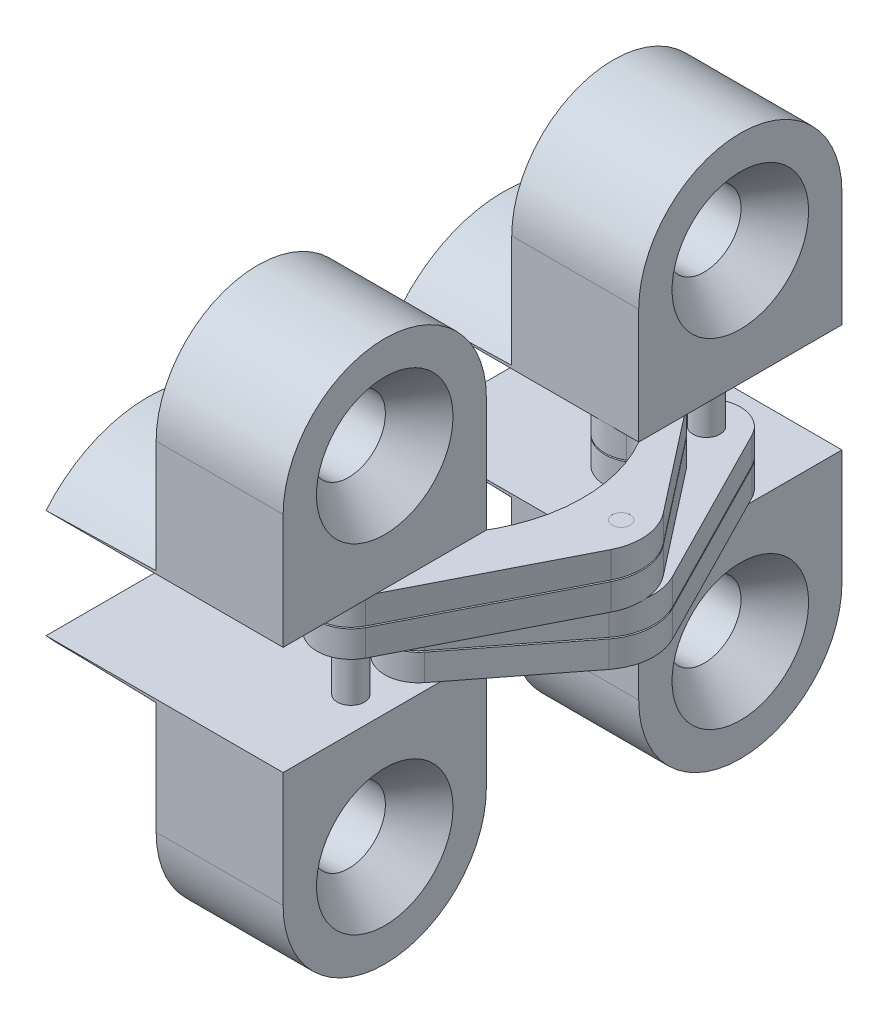
from build123d import *

# Parameters (mm, degrees)
EXTRUDE1_DEPTH                                = 11.1125
EXTRUDE1_2_DEPTH                              = 11.1125
SKETCH16_W                                    = 26.19375
SKETCH16_H                                    = 5.08
CUT_EXTRUDE1_DEPTH                            = 22.361315292
SKETCH34_R                                    = 0.635
SKETCH34_R_2                                  = 0.423333333
EXTRUDE18_DEPTH                               = 2.54
SKETCH35_R                                    = 0.635
SKETCH35_R_2                                  = 0.423333333
EXTRUDE19_DEPTH                               = 2.54
FILLET7_R                                     = 2.54
FILLET8_R                                     = 2.54
SKETCH13_R                                    = 0.635
EXTRUDE11_DEPTH                               = 5.08
EXTRUDE11_2_DEPTH                             = 5.08
EXTRUDE11_3_DEPTH                             = 5.08
EXTRUDE11_4_DEPTH                             = 5.08
CUT_EXTRUDE3_DEPTH                            = 22.361315292
CUT_EXTRUDE3_DEPTH_BACK                       = 22.361315292
SKETCH38_W                                    = 26.19375
SKETCH38_H                                    = 0.0635
CSK_FOR_5_FLAT_HEAD_MACHINE_SCREW1_AT_2_COUNT = 2
CSK_FOR_5_FLAT_HEAD_MACHINE_SCREW1_AT_2_PITCH = 16.66875
CSK_FOR_5_FLAT_HEAD_MACHINE_SCREW1_AT_3_COUNT = 2
CSK_FOR_5_FLAT_HEAD_MACHINE_SCREW1_AT_3_PITCH = 15.875
CSK_FOR_5_FLAT_HEAD_MACHINE_SCREW1_AT_4_COUNT = 2
CSK_FOR_5_FLAT_HEAD_MACHINE_SCREW1_AT_4_PITCH = 23.01875
SKETCH33_R                                    = 0.423333333
EXTRUDE17_DEPTH                               = 5.08
SKETCH32_OUTSIDE_W                            = 36.272
SKETCH32_OUTSIDE_H                            = 35.478
CUT_EXTRUDE2_DEPTH                            = 5.159375
CUT_EXTRUDE2_DRAFT                            = -1


with BuildPart() as part:
    # Sketch1 → Extrude1 (new body)
    with BuildSketch(Plane(origin=(0, 0, 0), x_dir=(0, 0, -1), z_dir=(1, 0, 0))):
        with BuildLine():
            Line((-13.096875, 7.9375), (-13.096875, -7.9375))
            ThreePointArc((-13.096875, -7.9375), (-8.334375, -12.7), (-3.571875, -7.9375))
            Line((-3.571875, -7.9375), (-3.571875, 7.9375))
            ThreePointArc((-3.571875, 7.9375), (-8.334375, 12.7), (-13.096875, 7.9375))
        make_face()
    extrude(amount=-EXTRUDE1_DEPTH)


with BuildPart() as body_2:
    # Sketch1 → Extrude1 2 (new body)
    with BuildSketch(Plane(origin=(0, 0, 0), x_dir=(0, 0, -1), z_dir=(1, 0, 0))):
        with BuildLine():
            Line((3.571875, 7.9375), (3.571875, -7.9375))
            ThreePointArc((3.571875, -7.9375), (8.334375, -12.7), (13.096875, -7.9375))
            Line((13.096875, -7.9375), (13.096875, 7.9375))
            ThreePointArc((13.096875, 7.9375), (8.334375, 12.7), (3.571875, 7.9375))
        make_face()
    extrude(amount=-EXTRUDE1_2_DEPTH)


with BuildPart() as cut_extrude1_tool:
    # Sketch16 → Cut-Extrude1 (new, through all)
    with BuildSketch(Plane(origin=(0, 0, 0), x_dir=(0, 0, -1), z_dir=(1, 0, 0))):
        Rectangle(SKETCH16_W, SKETCH16_H)
    extrude(amount=-CUT_EXTRUDE1_DEPTH)


with BuildPart() as part_1:
    add(part.part)

    # Cut-Extrude1: cut by cut_extrude1_tool
    add(cut_extrude1_tool.part, mode=Mode.SUBTRACT)


with BuildPart() as body_2_1:
    add(body_2.part)

    # Cut-Extrude1: cut by cut_extrude1_tool
    add(cut_extrude1_tool.part, mode=Mode.SUBTRACT)


with BuildPart() as cut_extrude1_piece_1:
    # of the separate pieces the step leaves, piece 1, a body of its own (cut_extrude1_pieces)
    add(part_1.part.solids().sort_by_distance((0, 7.9375, 3.571875))[0])

    # Sketch30 → CSK for #5 Flat Head Machine Screw1 (revolve, cut)
    with BuildSketch(Plane(origin=(0, 7.9375, 8.334375), x_dir=(0, 0, -1), z_dir=(0, 1, 0))):
        Polygon((0, 0), (0, 11.1125), (1.7272, 11.1125), (1.7272, 1.694722738), (3.2004, 0), align=None)
    csk_for_5_flat_head_machine_screw1 = revolve(axis=Axis((6.35, 7.9375, 8.334375), (-1, 0, 0)), mode=Mode.SUBTRACT)


with BuildPart() as cut_extrude1_piece_2:
    # of the separate pieces the step leaves, piece 2, a body of its own (cut_extrude1_pieces)
    add(part_1.part.solids().sort_by_distance((0, -7.9375, 3.571875))[0])

    # CSK for #5 Flat Head Machine Screw1 at 3: CSK for #5 Flat Head Machine Screw1 ×2
    with Locations(*[(0, -i * CSK_FOR_5_FLAT_HEAD_MACHINE_SCREW1_AT_3_PITCH, 0) for i in range(1, CSK_FOR_5_FLAT_HEAD_MACHINE_SCREW1_AT_3_COUNT)]):
        add(csk_for_5_flat_head_machine_screw1, mode=Mode.SUBTRACT)


with BuildPart() as cut_extrude1_piece_1_of_body_2:
    # of the separate pieces the step leaves, piece 1, a body of its own (cut_extrude1_pieces_of_body_2)
    add(body_2_1.part.solids().sort_by_distance((0, 7.9375, -13.096875))[0])

    # CSK for #5 Flat Head Machine Screw1 at 2: CSK for #5 Flat Head Machine Screw1 ×2
    with Locations(*[(0, 0, -i * CSK_FOR_5_FLAT_HEAD_MACHINE_SCREW1_AT_2_PITCH) for i in range(1, CSK_FOR_5_FLAT_HEAD_MACHINE_SCREW1_AT_2_COUNT)]):
        add(csk_for_5_flat_head_machine_screw1, mode=Mode.SUBTRACT)


with BuildPart() as cut_extrude1_piece_2_of_body_2:
    # of the separate pieces the step leaves, piece 2, a body of its own (cut_extrude1_pieces_of_body_2)
    add(body_2_1.part.solids().sort_by_distance((0, -7.9375, -13.096875))[0])

    # CSK for #5 Flat Head Machine Screw1 at 4: CSK for #5 Flat Head Machine Screw1 ×2
    with Locations(*[Vector(0, -0.689655172413793, -0.7241379310344829) * (i * CSK_FOR_5_FLAT_HEAD_MACHINE_SCREW1_AT_4_PITCH) for i in range(1, CSK_FOR_5_FLAT_HEAD_MACHINE_SCREW1_AT_4_COUNT)]):
        add(csk_for_5_flat_head_machine_screw1, mode=Mode.SUBTRACT)


with BuildPart() as body_5:
    # Sketch34 → Extrude18 (new body)
    with BuildSketch(Plane.XZ.offset(-2.54)):
        with BuildLine():
            Line((-0.173294523, 9.055609441), (4.445, 0))
            Line((4.445, 0), (-0.335245678, -6.135087746))
            ThreePointArc((-0.335245678, -6.135087746), (-3.145633171, -5.463311295), (-0.79375, -3.784559671))
            ThreePointArc((-0.79375, -3.784559671), (-0.352826562, -3.842608343), (0, -3.571875))
            ThreePointArc((0, -3.571875), (0.941237875, 0.475508106), (-0.529274955, 4.362001481))
            Line((-0.529274955, 4.362001481), (-2.844698672, 7.365041337))
            ThreePointArc((-2.844698672, 7.365041337), (-2.436421617, 9.675825088), (-0.173294523, 9.055609441))
        make_face()
        with Locations(Location((-1.5875, 8.334375, 0), (0, 0, 270))):
            Circle(SKETCH34_R, mode=Mode.SUBTRACT)
        with Locations(Location((-1.5875, -5.159375, 0), (0, 0, 270))):
            Circle(SKETCH34_R, mode=Mode.SUBTRACT)
        with Locations(Location((2.751666667, 0, 0), (0, 0, 270))):
            Circle(SKETCH34_R_2, mode=Mode.SUBTRACT)
    extrude(amount=EXTRUDE18_DEPTH)

    # Fillet7
    fillet7_edges = [body_5.edges().sort_by_distance(p)[0] for p in [
        (4.445, 1.27, 0),
    ]]
    fillet(fillet7_edges, radius=FILLET7_R)


with BuildPart() as body_6:
    # Sketch35 → Extrude19 (new body)
    with BuildSketch(Plane.XZ):
        with BuildLine():
            Line((-2.844698672, -7.365041337), (-0.529274955, -4.362001481))
            ThreePointArc((-0.529274955, -4.362001481), (0.941237875, -0.475508106), (0, 3.571875))
            ThreePointArc((0, 3.571875), (-0.352826562, 3.842608343), (-0.79375, 3.784559671))
            ThreePointArc((-0.79375, 3.784559671), (-3.145633171, 5.463311295), (-0.335245678, 6.135087746))
            Line((-0.335245678, 6.135087746), (4.445, 0))
            Line((4.445, 0), (-0.173294523, -9.055609441))
            ThreePointArc((-0.173294523, -9.055609441), (-2.436421617, -9.675825088), (-2.844698672, -7.365041337))
        make_face()
        with Locations(Location((-1.5875, -8.334375, 0), (0, 0, 270))):
            Circle(SKETCH35_R, mode=Mode.SUBTRACT)
        with Locations(Location((-1.5875, 5.159375, 0), (0, 0, 270))):
            Circle(SKETCH35_R, mode=Mode.SUBTRACT)
        with Locations(Location((2.751666667, 0, 0), (0, 0, 270))):
            Circle(SKETCH35_R_2, mode=Mode.SUBTRACT)
    extrude(amount=EXTRUDE19_DEPTH)

    # Fillet8
    fillet8_edges = [body_6.edges().sort_by_distance(p)[0] for p in [
        (4.445, -1.27, 0),
    ]]
    fillet(fillet8_edges, radius=FILLET8_R)


with BuildPart() as body_7:
    # Sketch13 → Extrude11 (new body)
    with BuildSketch(Plane(origin=(0, -2.54, 0), x_dir=(-1, 0, 0), z_dir=(0, 1, 0))):
        with Locations(Location((1.5875, 8.334375, 0), (0, 0, 90))):
            Circle(SKETCH13_R)
    extrude(amount=EXTRUDE11_DEPTH)


with BuildPart() as body_8:
    # Sketch13 → Extrude11 2 (new body)
    with BuildSketch(Plane(origin=(0, -2.54, 0), x_dir=(-1, 0, 0), z_dir=(0, 1, 0))):
        with Locations(Location((1.5875, 5.159375, 0), (0, 0, 90))):
            Circle(SKETCH13_R)
    extrude(amount=EXTRUDE11_2_DEPTH)


with BuildPart() as body_9:
    # Sketch13 → Extrude11 3 (new body)
    with BuildSketch(Plane(origin=(0, -2.54, 0), x_dir=(-1, 0, 0), z_dir=(0, 1, 0))):
        with Locations(Location((1.5875, -8.334375, 0), (0, 0, 90))):
            Circle(SKETCH13_R)
    extrude(amount=EXTRUDE11_3_DEPTH)


with BuildPart() as body_10:
    # Sketch13 → Extrude11 4 (new body)
    with BuildSketch(Plane(origin=(0, -2.54, 0), x_dir=(-1, 0, 0), z_dir=(0, 1, 0))):
        with Locations(Location((1.5875, -5.159375, 0), (0, 0, 90))):
            Circle(SKETCH13_R)
    extrude(amount=EXTRUDE11_4_DEPTH)


with BuildPart() as cut_extrude3_tool:
    # Sketch38 → Cut-Extrude3 (new, two sides: drawn at the far end of the back side and taken through both)
    with BuildSketch(Plane(origin=(0, 0, 0), x_dir=(0, 0, -1), z_dir=(1, 0, 0)).offset(-CUT_EXTRUDE3_DEPTH_BACK)):
        with Locations((0, 1.27)):
            Rectangle(SKETCH38_W, SKETCH38_H)
        with Locations((0, -1.27)):
            Rectangle(SKETCH38_W, SKETCH38_H)
    extrude(amount=CUT_EXTRUDE3_DEPTH + CUT_EXTRUDE3_DEPTH_BACK)


with BuildPart() as body_5_1:
    add(body_5.part)

    # Cut-Extrude3: cut by cut_extrude3_tool
    add(cut_extrude3_tool.part, mode=Mode.SUBTRACT)


with BuildPart() as body_6_1:
    add(body_6.part)

    # Cut-Extrude3: cut by cut_extrude3_tool
    add(cut_extrude3_tool.part, mode=Mode.SUBTRACT)


with BuildPart() as cut_extrude3_piece_1:
    # of the separate pieces the step leaves, piece 1, a body of its own (cut_extrude3_pieces)
    add(body_5_1.part.solids().sort_by_distance((3.710604976, 2.54, 1.440010913))[0])


with BuildPart() as cut_extrude3_piece_2:
    # of the separate pieces the step leaves, piece 2, a body of its own (cut_extrude3_pieces)
    add(body_5_1.part.solids().sort_by_distance((3.710604976, 1.23825, 1.440010913))[0])


with BuildPart() as cut_extrude3_piece_1_of_body_6:
    # of the separate pieces the step leaves, piece 1, a body of its own (cut_extrude3_pieces_of_body_6)
    add(body_6_1.part.solids().sort_by_distance((3.451483128, 0, 1.275104586))[0])


with BuildPart() as cut_extrude3_piece_2_of_body_6:
    # of the separate pieces the step leaves, piece 2, a body of its own (cut_extrude3_pieces_of_body_6)
    add(body_6_1.part.solids().sort_by_distance((3.451483128, -1.30175, 1.275104586))[0])


with BuildPart() as body_13:
    # Sketch33 → Extrude17 (new body)
    with BuildSketch(Plane.XZ.offset(-2.54)):
        with Locations(Location((2.751666667, 0, 0), (0, 0, 270))):
            Circle(SKETCH33_R)
    extrude(amount=EXTRUDE17_DEPTH)


with BuildPart() as cut_extrude2_tool:
    # Sketch32 outside → Cut-Extrude2 (with draft: the straight prism first)
    with BuildSketch(Plane.ZY.offset(11.1125)):
        Rectangle(SKETCH32_OUTSIDE_W, SKETCH32_OUTSIDE_H)
        with BuildLine():
            Line((-13.096875, 2.54), (-13.096875, -2.54))
            ThreePointArc((-13.096875, -2.54), (-8.334375, -4.7625), (-3.571875, -2.54))
            Line((-3.571875, -2.54), (-3.571875, 2.54))
            ThreePointArc((-3.571875, 2.54), (-8.334375, 4.7625), (-13.096875, 2.54))
        make_face(mode=Mode.SUBTRACT)
        with BuildLine():
            Line((3.571875, 2.54), (3.571875, -2.54))
            ThreePointArc((3.571875, -2.54), (8.334375, -4.7625), (13.096875, -2.54))
            Line((13.096875, -2.54), (13.096875, 2.54))
            ThreePointArc((13.096875, 2.54), (8.334375, 4.7625), (3.571875, 2.54))
        make_face(mode=Mode.SUBTRACT)
    extrude(amount=-CUT_EXTRUDE2_DEPTH)
    # Cut-Extrude2: the draft: its side faces are tilted about the plane it starts from
    cut_extrude2_sides = [cut_extrude2_tool.faces().sort_by_distance(p)[0] for p in [
        (-8.5328125, -17.739, 0),
        (-8.5328125, 0, 18.136),
        (-8.5328125, 17.739, 0),
        (-8.5328125, 0, -18.136),
        (-8.5328125, 0, -3.571875),
        (-8.5328125, -4.7625, -8.334375),
        (-8.5328125, 0, -13.096875),
        (-8.5328125, 4.7625, -8.334375),
        (-8.5328125, 0, 13.096875),
        (-8.5328125, -4.7625, 8.334375),
        (-8.5328125, 0, 3.571875),
        (-8.5328125, 4.7625, 8.334375),
    ]]
    draft(cut_extrude2_sides, Plane.ZY.offset(11.1125), CUT_EXTRUDE2_DRAFT)


with BuildPart() as cut_extrude1_piece_1_1:
    add(cut_extrude1_piece_1.part)

    # Cut-Extrude2: cut by cut_extrude2_tool
    add(cut_extrude2_tool.part, mode=Mode.SUBTRACT)


with BuildPart() as cut_extrude1_piece_2_1:
    add(cut_extrude1_piece_2.part)

    # Cut-Extrude2: cut by cut_extrude2_tool
    add(cut_extrude2_tool.part, mode=Mode.SUBTRACT)


with BuildPart() as cut_extrude1_piece_1_of_body_2_1:
    add(cut_extrude1_piece_1_of_body_2.part)

    # Cut-Extrude2: cut by cut_extrude2_tool
    add(cut_extrude2_tool.part, mode=Mode.SUBTRACT)


with BuildPart() as cut_extrude1_piece_2_of_body_2_1:
    add(cut_extrude1_piece_2_of_body_2.part)

    # Cut-Extrude2: cut by cut_extrude2_tool
    add(cut_extrude2_tool.part, mode=Mode.SUBTRACT)


solid = Compound([body_7.part, body_8.part, body_9.part, body_10.part, cut_extrude3_piece_1.part, cut_extrude3_piece_2.part, cut_extrude3_piece_1_of_body_6.part, cut_extrude3_piece_2_of_body_6.part, body_13.part, cut_extrude1_piece_1_1.part, cut_extrude1_piece_2_1.part, cut_extrude1_piece_1_of_body_2_1.part, cut_extrude1_piece_2_of_body_2_1.part])
